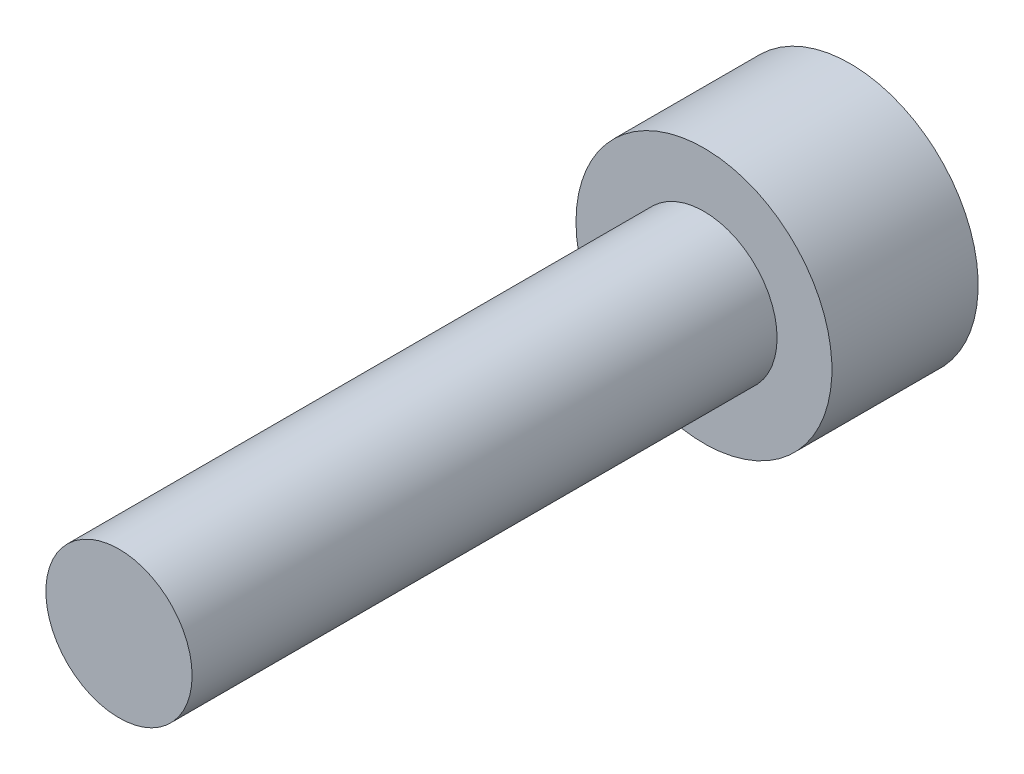
from build123d import *

# Parameters (mm, degrees)
SKETCH1_W           = 3.5
SKETCH1_H           = 4
SKETCH2_R           = 2
BOSS_EXTRUDE1_DEPTH = 16
CUT_EXTRUDE1_DEPTH  = 2.4


with BuildPart() as part:
    # Sketch1 → Revolve1 (revolve)
    with BuildSketch(Plane.XZ, mode=Mode.PRIVATE) as revolve1_sk:
        with Locations((1.75, 2)):
            Rectangle(SKETCH1_W, SKETCH1_H)
    revolve(revolve1_sk.sketch.rotate(Axis((0, 0, 4), (0, 0, -1)), 180), axis=Axis((0, 0, 4), (0, 0, -1)))

    # Sketch2 → Boss-Extrude1 (add)
    with BuildSketch(Plane.XY.offset(4)):
        Circle(SKETCH2_R)
    extrude(amount=BOSS_EXTRUDE1_DEPTH)

    # Sketch3 → Cut-Extrude1 (cut)
    with BuildSketch(Plane(origin=(0, 0, 0), x_dir=(-1, 0, 0), z_dir=(0, 0, -1))):
        Polygon((-1.7, 0), (-0.85, -1.472243186), (0.85, -1.472243186), (1.7, 0), (0.85, 1.472243186), (-0.85, 1.472243186), align=None)
    extrude(amount=-CUT_EXTRUDE1_DEPTH, mode=Mode.SUBTRACT)


solid = part.part
